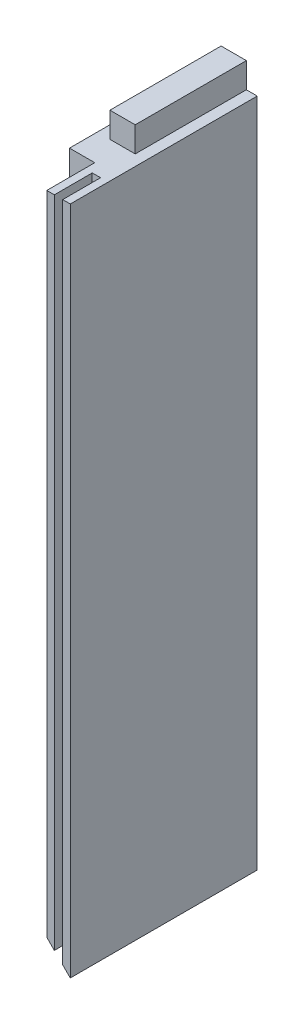
from build123d import *

# Parameters (mm, degrees)
BOSS_EXTRUDE1_DEPTH = 265.3
SKETCH2_W           = 10
SKETCH2_H           = 44
BOSS_EXTRUDE2_DEPTH = 10
SKETCH3_W           = 381.110289958
SKETCH3_H           = 88.245673433
CUT_EXTRUDE1_DEPTH  = 27
SKETCH4_W           = 28
SKETCH4_H           = 7
BOSS_EXTRUDE3_DEPTH = 7


with BuildPart() as part:
    # Sketch1 → Boss-Extrude1 (new body)
    with BuildSketch(Plane(origin=(0, 0, 0), x_dir=(1, 0, 0), z_dir=(0, 1, 0))):
        Polygon((-51.505795374, 37), (-51.505795374, -18), (-41.505795374, -18), (-41.505795374, -37), (-38.505795374, -37), (-38.505795374, -22), (-35.205795374, -22), (-35.205795374, -37), (-32.205795374, -37), (-32.205795374, 37), align=None)
    extrude(amount=BOSS_EXTRUDE1_DEPTH)

    # Sketch2 → Boss-Extrude2 (add)
    with BuildSketch(Plane(origin=(0, 265.3, 0), x_dir=(1, 0, 0), z_dir=(0, 1, 0))):
        with Locations((-41.505795374, 15)):
            Rectangle(SKETCH2_W, SKETCH2_H)
    extrude(amount=BOSS_EXTRUDE2_DEPTH)

    # Sketch3 → Cut-Extrude1 (cut)
    with BuildSketch(Plane(origin=(-16.102897687, -16.102897687, 0), x_dir=(0, 0, -1), z_dir=(-0.7071067811865488, -0.7071067811865464, 0))):
        with Locations((41.438548882, -32.158306753)):
            Rectangle(SKETCH3_W, SKETCH3_H)
    extrude(amount=CUT_EXTRUDE1_DEPTH, mode=Mode.SUBTRACT)

    # Sketch4 → Boss-Extrude3 (add)
    with BuildSketch(Plane(origin=(-16.102897687, -16.102897687, 0), x_dir=(0, 0, 1), z_dir=(-0.7071067811865487, -0.7071067811865465, 0))):
        with Locations((-11, 40.567258056)):
            Rectangle(SKETCH4_W, SKETCH4_H)
    extrude(amount=BOSS_EXTRUDE3_DEPTH)


solid = part.part
